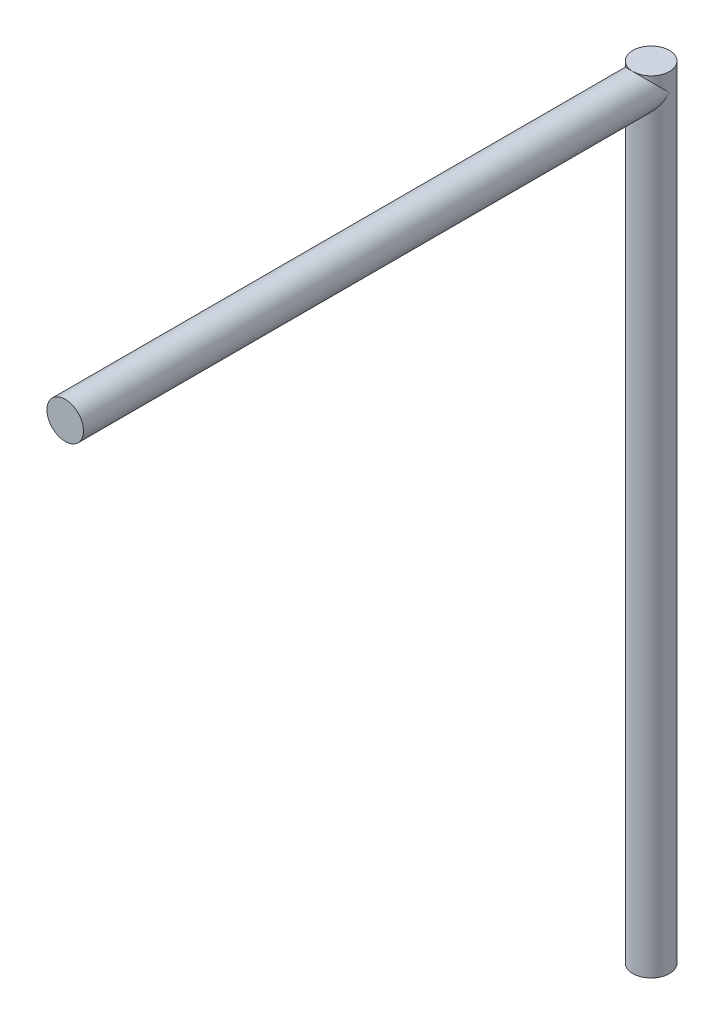
from build123d import *

# Parameters (mm, degrees)
SKETCH1_R           = 4.7625
BOSS_EXTRUDE1_DEPTH = 203.2
SKETCH2_R           = 4.7625
BOSS_EXTRUDE2_DEPTH = 152.4


with BuildPart() as part:
    # Sketch1 → Boss-Extrude1 (new body)
    with BuildSketch(Plane(origin=(0, 0, 0), x_dir=(1, 0, 0), z_dir=(0, 1, 0))):
        with Locations(Location((0, 0, 0), (0, 0, 270))):
            Circle(SKETCH1_R)
    extrude(amount=BOSS_EXTRUDE1_DEPTH)

    # Sketch2 → Boss-Extrude2 (add)
    with BuildSketch(Plane.XY):
        with Locations((0, 198.4375)):
            Circle(SKETCH2_R)
    extrude(amount=BOSS_EXTRUDE2_DEPTH)


solid = part.part
